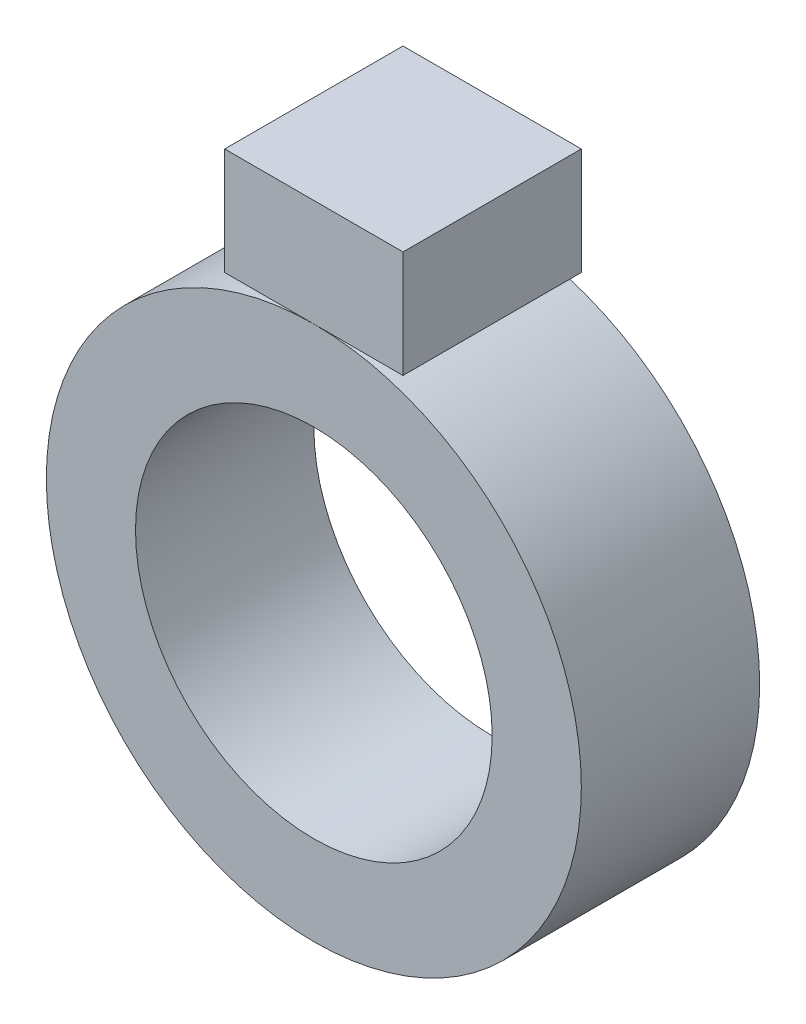
from build123d import *

# Parameters (mm, degrees)
SKETCH1_R           = 7.5
SKETCH1_R_2         = 5
BOSS_EXTRUDE1_DEPTH = 5
SKETCH2_W           = 5
SKETCH2_H           = 5
BOSS_EXTRUDE2_DEPTH = 3


with BuildPart() as part:
    # Sketch1 → Boss-Extrude1 (new body)
    with BuildSketch(Plane.XY):
        Circle(SKETCH1_R)
        Circle(SKETCH1_R_2, mode=Mode.SUBTRACT)
    extrude(amount=BOSS_EXTRUDE1_DEPTH)


with BuildPart() as body_2:
    # Sketch2 → Boss-Extrude2 (new body)
    with BuildSketch(Plane(origin=(0, 7.5, 0), x_dir=(1, 0, 0), z_dir=(0, 1, 0))):
        with Locations((0, -2.5)):
            Rectangle(SKETCH2_W, SKETCH2_H)
    extrude(amount=BOSS_EXTRUDE2_DEPTH)


solid = Compound([part.part, body_2.part])
